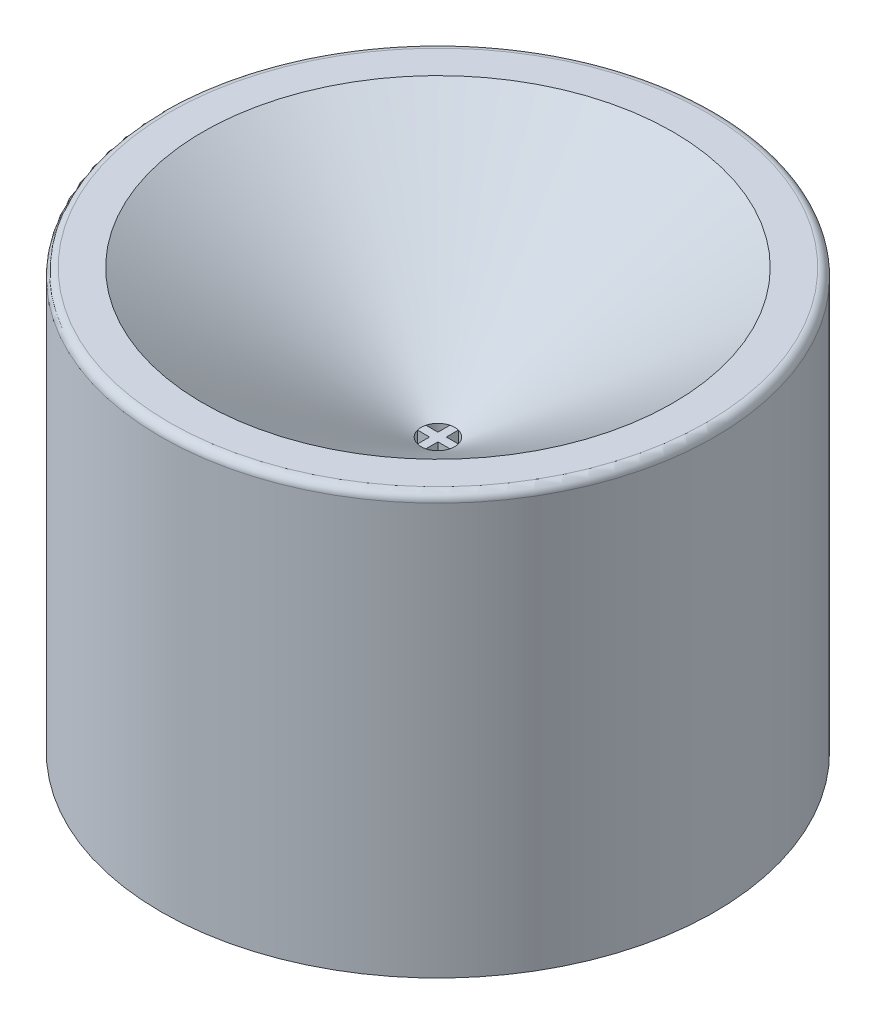
from build123d import *

# Parameters (mm, degrees)
SKETCH1_R           = 83.82
BOSS_EXTRUDE1_DEPTH = 127
SHELL1_T            = -6.35
CUT_EXTRUDE2_REACH  = 146.451
FILLET2_R           = 2.54


with BuildPart() as part:
    # Sketch1 → Boss-Extrude1 (new body)
    with BuildSketch(Plane(origin=(0, 0, 0), x_dir=(1, 0, 0), z_dir=(0, 1, 0))):
        with Locations(Location((0, 0, 0), (0, 0, 270))):
            Circle(SKETCH1_R)
    extrude(amount=BOSS_EXTRUDE1_DEPTH)

    # Sketch2 → Cut-Revolve1 (revolve, cut)
    with BuildSketch(Plane.XY, mode=Mode.PRIVATE) as cut_revolve1_sk:
        Polygon((-5.08, 82.55), (0, 82.55), (0, 127), (-71.12, 127), align=None)
    revolve(cut_revolve1_sk.sketch.rotate(Axis((0, 0, 0), (0, 1, 0)), 90), axis=Axis((0, 0, 0), (0, 1, 0)), mode=Mode.SUBTRACT)

    # Shell1
    shell1_openings = [part.faces().sort_by_distance(p)[0] for p in [
        (0, 0, 0),
    ]]
    offset(amount=SHELL1_T, openings=shell1_openings, kind=Kind.INTERSECTION)

    # Sketch4 → Cut-Extrude2 (cut, up to next)
    with BuildSketch(Plane(origin=(0, 82.55, 0), x_dir=(1, 0, 0), z_dir=(0, 1, 0)), mode=Mode.PRIVATE) as cut_extrude2_sk1:
        with BuildLine():
            Line((-1.27, 1.27), (-1.27, 4.91868885))
            ThreePointArc((-1.27, 4.91868885), (-3.592102448, 3.592102448), (-4.91868885, 1.27))
            Line((-4.91868885, 1.27), (-1.27, 1.27))
        make_face()
    cut_extrude2_tool1 = extrude(cut_extrude2_sk1.sketch, amount=-CUT_EXTRUDE2_REACH, mode=Mode.PRIVATE) & part.part
    # Sketch4 → Cut-Extrude2 (cut, up to next)
    with BuildSketch(Plane(origin=(0, 82.55, 0), x_dir=(1, 0, 0), z_dir=(0, 1, 0)), mode=Mode.PRIVATE) as cut_extrude2_sk2:
        with BuildLine():
            ThreePointArc((4.91868885, 1.27), (3.592102448, 3.592102448), (1.27, 4.91868885))
            Line((1.27, 4.91868885), (1.27, 1.27))
            Line((1.27, 1.27), (4.91868885, 1.27))
        make_face()
    cut_extrude2_tool2 = extrude(cut_extrude2_sk2.sketch, amount=-CUT_EXTRUDE2_REACH, mode=Mode.PRIVATE) & part.part
    # Sketch4 → Cut-Extrude2 (cut, up to next)
    with BuildSketch(Plane(origin=(0, 82.55, 0), x_dir=(1, 0, 0), z_dir=(0, 1, 0)), mode=Mode.PRIVATE) as cut_extrude2_sk3:
        with BuildLine():
            Line((-1.27, -4.91868885), (-1.27, -1.27))
            Line((-1.27, -1.27), (-4.91868885, -1.27))
            ThreePointArc((-4.91868885, -1.27), (-3.592102448, -3.592102448), (-1.27, -4.91868885))
        make_face()
    cut_extrude2_tool3 = extrude(cut_extrude2_sk3.sketch, amount=-CUT_EXTRUDE2_REACH, mode=Mode.PRIVATE) & part.part
    # Sketch4 → Cut-Extrude2 (cut, up to next)
    with BuildSketch(Plane(origin=(0, 82.55, 0), x_dir=(1, 0, 0), z_dir=(0, 1, 0)), mode=Mode.PRIVATE) as cut_extrude2_sk4:
        with BuildLine():
            Line((4.91868885, -1.27), (1.27, -1.27))
            Line((1.27, -1.27), (1.27, -4.91868885))
            ThreePointArc((1.27, -4.91868885), (3.592102448, -3.592102448), (4.91868885, -1.27))
        make_face()
    cut_extrude2_tool4 = extrude(cut_extrude2_sk4.sketch, amount=-CUT_EXTRUDE2_REACH, mode=Mode.PRIVATE) & part.part
    add(cut_extrude2_tool1.solids().sort_by_distance((-2.704204, 82.55, -2.704204))[0], mode=Mode.SUBTRACT)
    add(cut_extrude2_tool2.solids().sort_by_distance((2.704204, 82.55, -2.704204))[0], mode=Mode.SUBTRACT)
    add(cut_extrude2_tool3.solids().sort_by_distance((-2.704204, 82.55, 2.704204))[0], mode=Mode.SUBTRACT)
    add(cut_extrude2_tool4.solids().sort_by_distance((2.704204, 82.55, 2.704204))[0], mode=Mode.SUBTRACT)

    # Fillet2
    fillet2_edges = [part.edges().sort_by_distance(p)[0] for p in [
        (0, 127, -83.82),
    ]]
    fillet(fillet2_edges, radius=FILLET2_R)


solid = part.part
